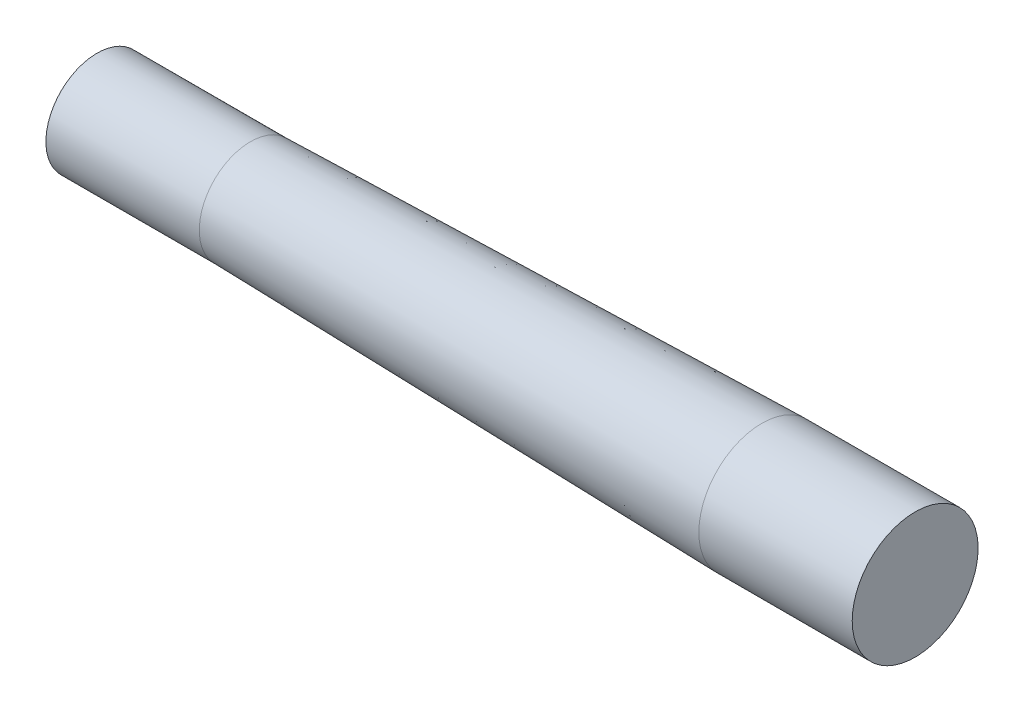
from build123d import *

# Parameters (mm, degrees)
SKETCH7_R           = 102.108
SKETCH9_R           = 125.73
SKETCH11_R          = 102.108
BOSS_EXTRUDE1_DEPTH = 306.324
SKETCH12_R          = 125.73
BOSS_EXTRUDE2_DEPTH = 306.324


with BuildPart() as part:
    # Sketch7 → Loft3 section 0
    with BuildSketch(Plane(origin=(0, 0, 0), x_dir=(0, 0, -1), z_dir=(1, 0, 0))):
        Circle(SKETCH7_R)
    # Sketch9 → Loft3 section 1
    with BuildSketch(Plane(origin=(1021.373155762, 0, 0), x_dir=(0, 0, -1), z_dir=(1, 0, 0))):
        Circle(SKETCH9_R)
    loft()

    # Sketch11 → Boss-Extrude1 (add)
    with BuildSketch(Plane.ZY):
        with Locations(Location((0, 0, 0), (0, 0, 180))):
            Circle(SKETCH11_R)
    extrude(amount=BOSS_EXTRUDE1_DEPTH)

    # Sketch12 → Boss-Extrude2 (add)
    with BuildSketch(Plane(origin=(1021.373155762, 0, 0), x_dir=(0, 0, -1), z_dir=(1, 0, 0))):
        with Locations(Location((0, 0, 0), (0, 0, 180))):
            Circle(SKETCH12_R)
    extrude(amount=BOSS_EXTRUDE2_DEPTH)


solid = part.part
